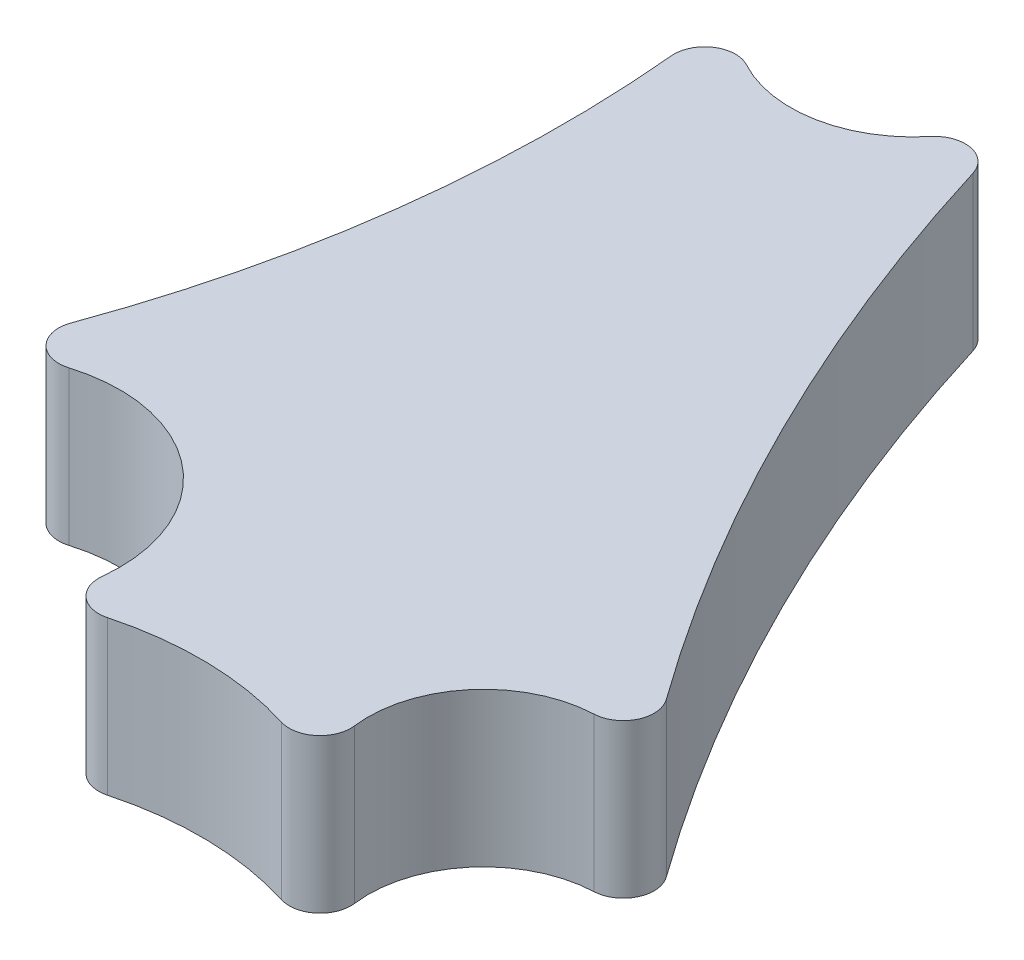
from build123d import *

# Parameters (mm, degrees)
BOSS_EXTRUDE1_DEPTH = 12.7
FILLET1_R           = 2.54


with BuildPart() as part:
    # Sketch1 → Boss-Extrude1 (new body)
    with BuildSketch(Plane(origin=(0, 0, 0), x_dir=(1, 0, 0), z_dir=(0, 1, 0))):
        with BuildLine():
            ThreePointArc((-9.841918443, 8.026620793), (4.260142942, 11.964162408), (12.7, 0))
            ThreePointArc((12.7, 0), (12.349099919, -2.964748082), (11.315790364, -5.765664614))
            ThreePointArc((11.315790364, -5.765664614), (23.993952322, -3.244561181), (36.340951501, -7.071226105))
            ThreePointArc((36.340951501, -7.071226105), (36.414038972, 6.267321996), (49.751485572, 6.453669581))
            ThreePointArc((49.751485572, 6.453669581), (30.344153641, 36.906923092), (17.672267645, 70.722133981))
            ThreePointArc((17.672267645, 70.722133981), (8.792640174, 60.643133724), (-2.325024911, 68.181804248))
            ThreePointArc((-2.325024911, 68.181804248), (-1.446618844, 37.524798959), (-9.841918443, 8.026620793))
        make_face()
    extrude(amount=BOSS_EXTRUDE1_DEPTH)

    # Fillet1
    fillet1_edges = [part.edges().sort_by_distance(p)[0] for p in [
        (-9.841918443, 6.35, -8.026620793),
        (-2.325024911, 6.35, -68.181804248),
        (17.672267645, 6.35, -70.722133981),
        (49.751485572, 6.35, -6.453669581),
        (36.340951501, 6.35, 7.071226105),
        (11.315790364, 6.35, 5.765664614),
    ]]
    fillet(fillet1_edges, radius=FILLET1_R)


solid = part.part
